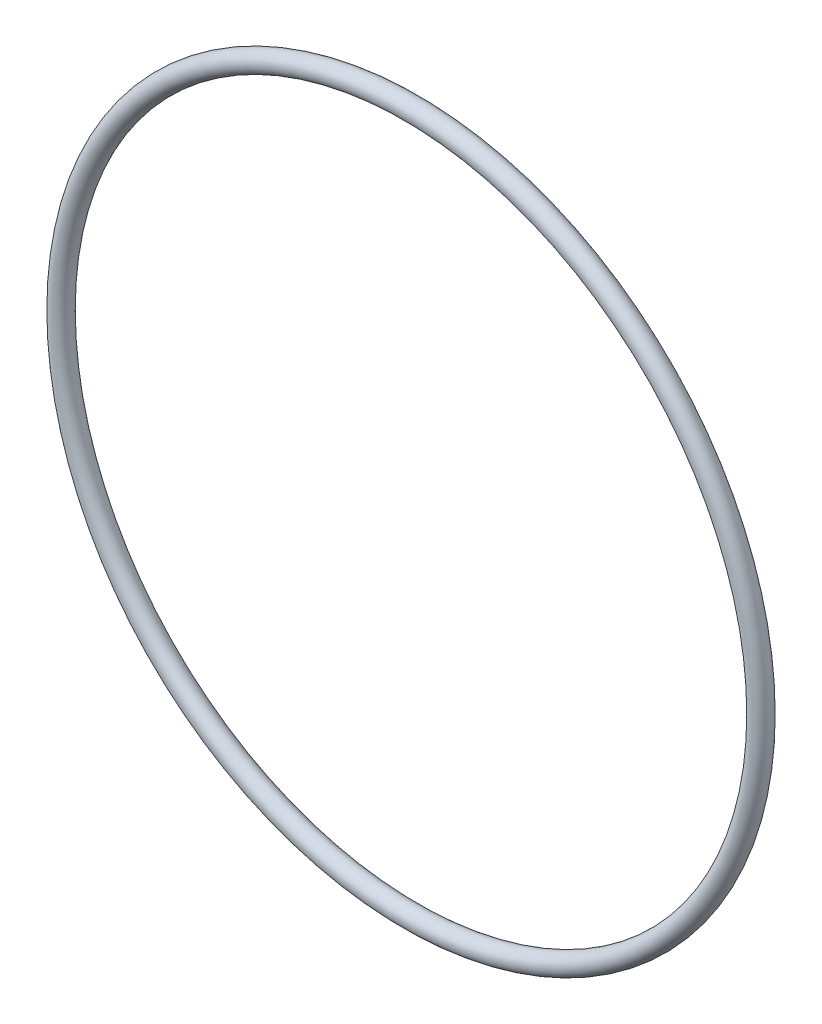
from build123d import *

# Parameters (mm, degrees)
BASE_SWEEP_PROFILE_R = 1.5875


with BuildPart() as part:
    # Base-Sweep: sweep along a path in Sketch-Path
    with BuildLine(Plane.XY) as base_sweep_path:
        CenterArc((0, 0), 55.245, 0, 360)
    # Base-Sweep profile (on start of the path) → Base-Sweep (sweep)
    with BuildSketch(Plane(origin=(55.245, 0, 0), x_dir=(0, 0, 1), z_dir=(0, 1, 0))):
        Circle(BASE_SWEEP_PROFILE_R)
    sweep(path=base_sweep_path.line)


solid = part.part
